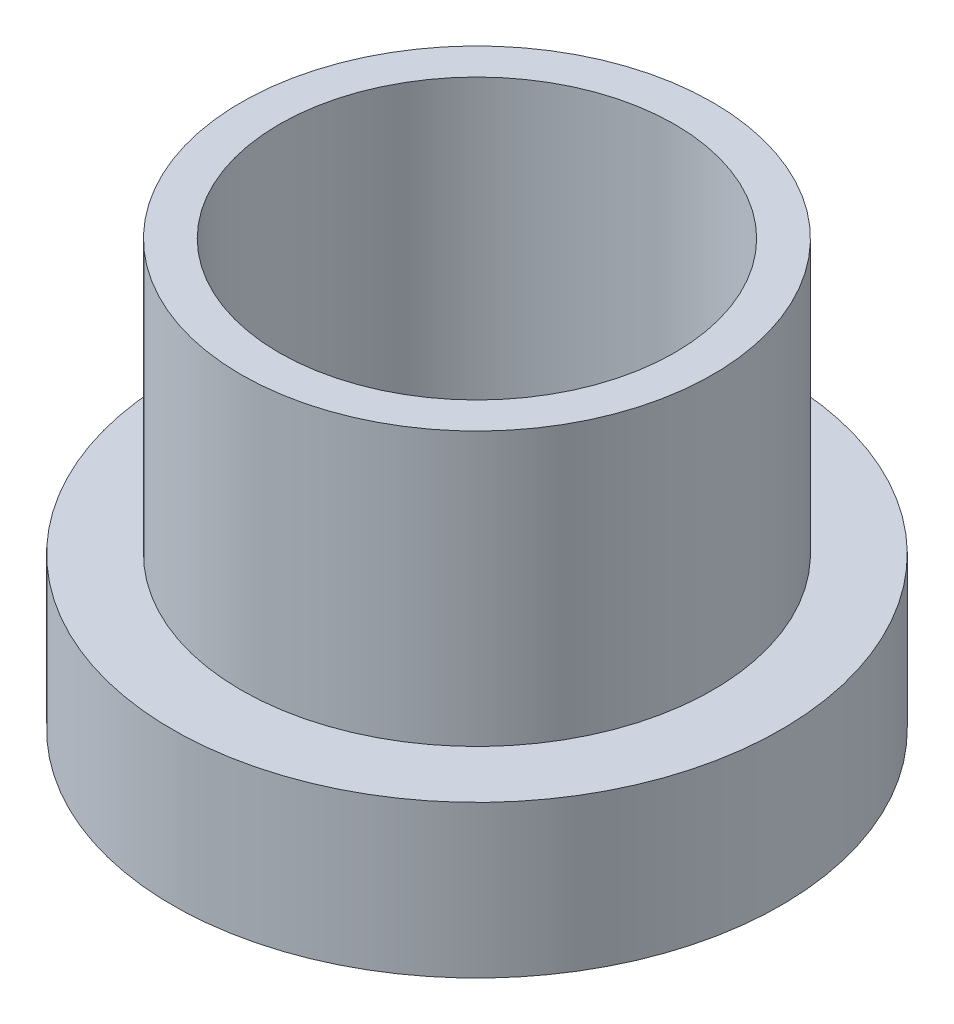
from build123d import *

# Parameters (mm, degrees)
SKETCH1_R           = 3.1
SKETCH1_R_2         = 2.6
BOSS_EXTRUDE1_DEPTH = 5.590882
SKETCH2_R           = 4
SKETCH2_R_2         = 2.6
BOSS_EXTRUDE2_DEPTH = 2


with BuildPart() as part:
    # Sketch1 → Boss-Extrude1 (new body)
    with BuildSketch(Plane(origin=(0, 0, 0), x_dir=(1, 0, 0), z_dir=(0, 1, 0))):
        with Locations(Location((0, 0, 0), (0, 0, 270))):
            Circle(SKETCH1_R)
        with Locations(Location((0, 0, 0), (0, 0, 270))):
            Circle(SKETCH1_R_2, mode=Mode.SUBTRACT)
    extrude(amount=BOSS_EXTRUDE1_DEPTH)

    # Sketch2 → Boss-Extrude2 (add)
    with BuildSketch(Plane.XZ):
        with Locations(Location((0, 0, 0), (0, 0, 270))):
            Circle(SKETCH2_R)
        with Locations(Location((0, 0, 0), (0, 0, 90))):
            Circle(SKETCH2_R_2, mode=Mode.SUBTRACT)
    extrude(amount=-BOSS_EXTRUDE2_DEPTH)


solid = part.part
